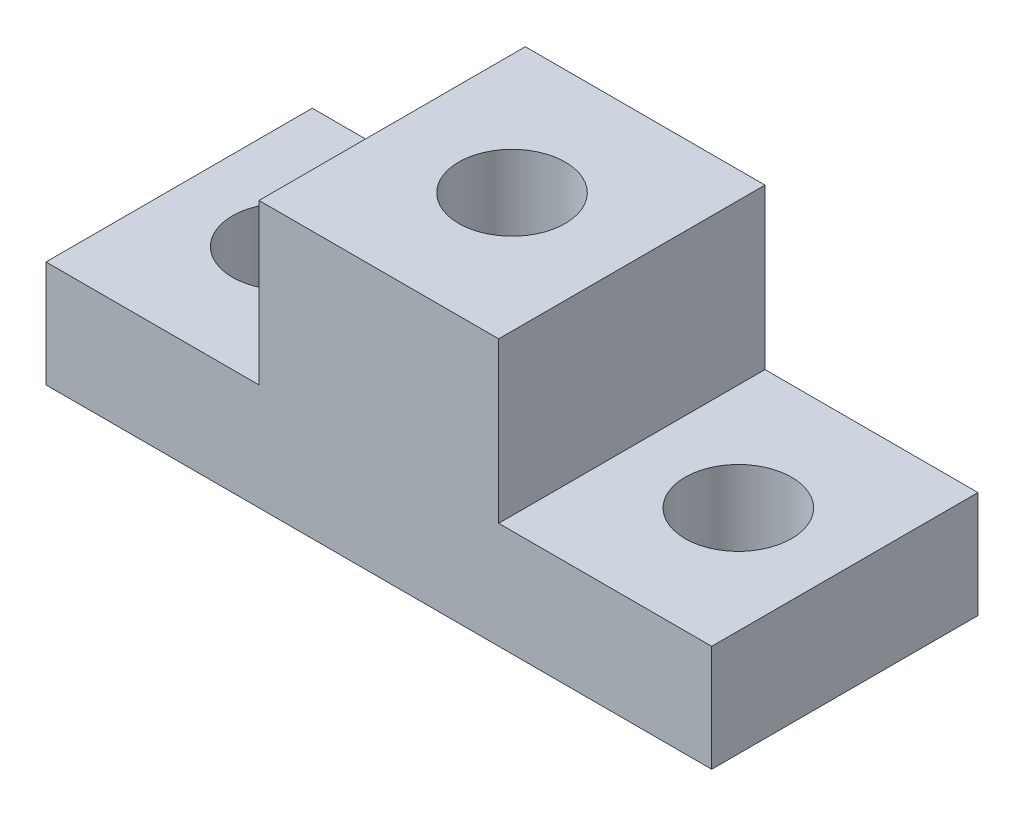
from build123d import *

# Parameters (mm, degrees)
SKETCH1_W           = 25
SKETCH1_H           = 10
BOSS_EXTRUDE1_DEPTH = 10
SKETCH2_W           = 8
SKETCH2_H           = 6
CUT_EXTRUDE1_DEPTH  = 10
SKETCH3_R           = 2
CUT_EXTRUDE2_DEPTH  = 17.770509831
SKETCH4_R           = 2
CUT_EXTRUDE3_DEPTH  = 10


with BuildPart() as part:
    # Sketch1 → Boss-Extrude1 (new body)
    with BuildSketch(Plane(origin=(0, 0, 0), x_dir=(1, 0, 0), z_dir=(0, 1, 0))):
        Rectangle(SKETCH1_W, SKETCH1_H)
    extrude(amount=BOSS_EXTRUDE1_DEPTH)

    # Sketch2 → Cut-Extrude1 (cut)
    with BuildSketch(Plane.XY.offset(5)):
        with Locations((-8.5, 7)):
            Rectangle(SKETCH2_W, SKETCH2_H)
        with Locations((8.5, 7)):
            Rectangle(SKETCH2_W, SKETCH2_H)
    extrude(amount=-CUT_EXTRUDE1_DEPTH, mode=Mode.SUBTRACT)

    # Sketch3 → Cut-Extrude2 (cut, through all)
    with BuildSketch(Plane(origin=(0, 10, 0), x_dir=(1, 0, 0), z_dir=(0, 1, 0))):
        with Locations(Location((0, 0, 0), (0, 0, 270))):
            Circle(SKETCH3_R)
    extrude(amount=-CUT_EXTRUDE2_DEPTH, mode=Mode.SUBTRACT)

    # Sketch4 → Cut-Extrude3 (cut)
    with BuildSketch(Plane(origin=(0, 4, 0), x_dir=(1, 0, 0), z_dir=(0, 1, 0))):
        with Locations(Location((-8.5, 0, 0), (0, 0, 270))):
            Circle(SKETCH4_R)
        with Locations(Location((8.5, 0, 0), (0, 0, 270))):
            Circle(SKETCH4_R)
    extrude(amount=-CUT_EXTRUDE3_DEPTH, mode=Mode.SUBTRACT)


solid = part.part
